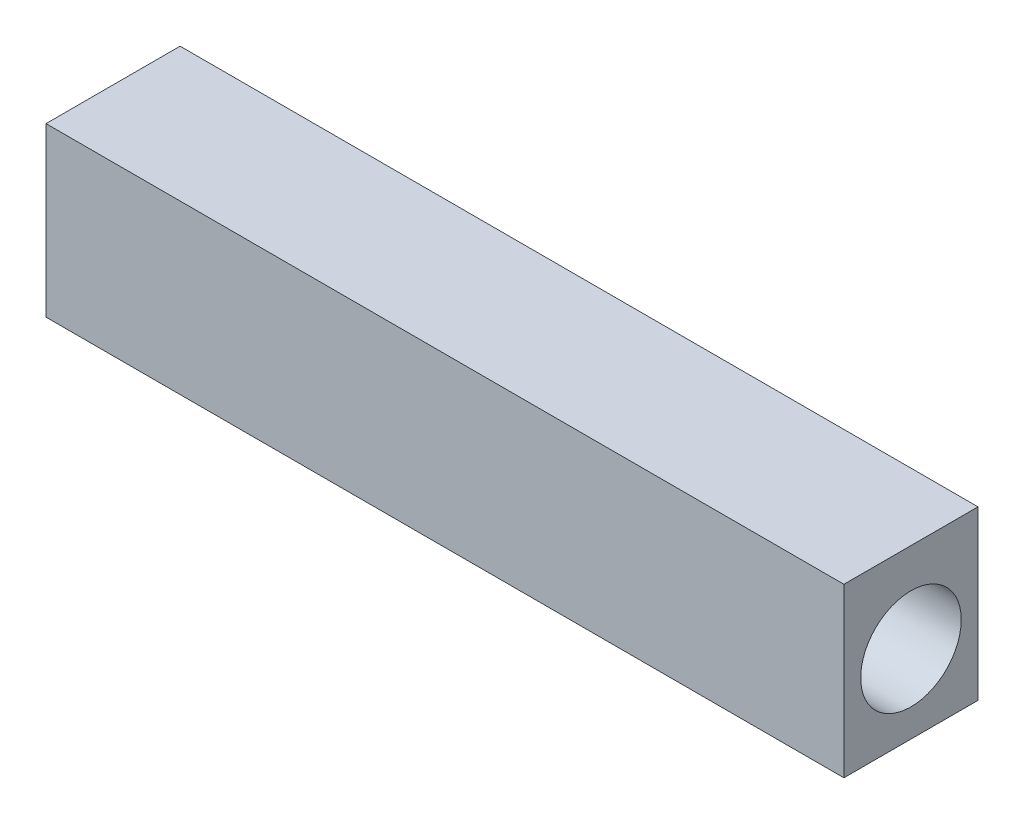
from build123d import *

# Parameters (mm, degrees)
SKETCH_1_W          = 32.4
SKETCH_1_H          = 12
EXTRUDE_1_DEPTH     = 10
SKETCH_4_R          = 4
CUT_EXTRUDE_2_DEPTH = 8.5
SKETCH_7_R          = 3.4
CUT_EXTRUDE_3_DEPTH = 7.9
SKETCH_8_R          = 4.5
CUT_EXTRUDE_4_DEPTH = 16
SKETCH_9_W          = 32.4
SKETCH_9_H          = 2.645898034
EXTRUDE_2_DEPTH     = 5
EXTRUDE_3_DEPTH     = 5
EXTRUDE_4_DEPTH     = 5
SKETCH_12_W         = 12
SKETCH_12_H         = 5
EXTRUDE_5_DEPTH     = 32.4
SKETCH_13_R         = 4
CUT_EXTRUDE_5_DEPTH = 8.5
SKETCH_14_R         = 3.4
CUT_EXTRUDE_6_DEPTH = 7.9
SKETCH_15_R         = 4.5
CUT_EXTRUDE_8_DEPTH = 16
SKETCH_16_W         = 12
SKETCH_16_H         = 15
EXTRUDE_8_DEPTH     = 39
SKETCH_17_R         = 4.5
CUT_EXTRUDE_9_DEPTH = 39


with BuildPart() as part:
    # 草圖1 → 填料-伸長1 (new body)
    with BuildSketch(Plane(origin=(0, 0, 0), x_dir=(1, 0, 0), z_dir=(0, 1, 0))):
        Rectangle(SKETCH_1_W, SKETCH_1_H)
    extrude(amount=EXTRUDE_1_DEPTH)

    # 草圖4 → 除料-伸長2 (cut)
    with BuildSketch(Plane.ZY.offset(16.2)):
        with Locations((0, 7)):
            Circle(SKETCH_4_R)
    extrude(amount=-CUT_EXTRUDE_2_DEPTH, mode=Mode.SUBTRACT)

    # 草圖7 → 除料-伸長3 (cut)
    with BuildSketch(Plane.ZY.offset(7.7)):
        with Locations((0, 7)):
            Circle(SKETCH_7_R)
    extrude(amount=-CUT_EXTRUDE_3_DEPTH, mode=Mode.SUBTRACT)

    # 草圖8 → 除料-伸長4 (cut)
    with BuildSketch(Plane(origin=(16.2, 0, 0), x_dir=(0, 0, -1), z_dir=(1, 0, 0))):
        with Locations((0, 7)):
            Circle(SKETCH_8_R)
    extrude(amount=-CUT_EXTRUDE_4_DEPTH, mode=Mode.SUBTRACT)

    # 草圖9 → 填料-伸長2 (add)
    with BuildSketch(Plane(origin=(0, 10, 0), x_dir=(1, 0, 0), z_dir=(0, 1, 0))):
        with Locations((0, 4.677050983)):
            Rectangle(SKETCH_9_W, SKETCH_9_H)
    extrude(amount=EXTRUDE_2_DEPTH)

    # 草圖10 → 填料-伸長3 (add)
    with BuildSketch(Plane(origin=(0, 10, 0), x_dir=(1, 0, 0), z_dir=(0, 1, 0))):
        Polygon((-16.2, 3.372532617), (-16.2, 2.685476071), (-7.7, 2.645751311), (-7.7, 1.6), (0.2, 1.6), (0.2, 3.354101966), align=None)
    extrude(amount=EXTRUDE_3_DEPTH)

    # 草圖11 → 填料-伸長4 (add)
    with BuildSketch(Plane(origin=(0, 10, 0), x_dir=(1, 0, 0), z_dir=(0, 1, 0))):
        Polygon((-16.2, -2.660675208), (-16.2, -6), (16.2, -6), (16.2, -3.354101966), (0.2, -3.354101966), (0.2, -1.6), (-7.7, -1.6), (-7.7, -2.645751311), align=None)
    extrude(amount=EXTRUDE_4_DEPTH)

    # 草圖12 → 填料-伸長5 (add, through all)
    with BuildSketch(Plane.ZY.offset(16.2)):
        with Locations((0, 12.5)):
            Rectangle(SKETCH_12_W, SKETCH_12_H)
    extrude(amount=-EXTRUDE_5_DEPTH)

    # 草圖13 → 除料-伸長5 (cut)
    with BuildSketch(Plane.ZY.offset(16.2)):
        with Locations((0, 7)):
            Circle(SKETCH_13_R)
    extrude(amount=-CUT_EXTRUDE_5_DEPTH, mode=Mode.SUBTRACT)

    # 草圖14 → 除料-伸長6 (cut)
    with BuildSketch(Plane.ZY.offset(7.7)):
        with Locations((0, 7)):
            Circle(SKETCH_14_R)
    extrude(amount=-CUT_EXTRUDE_6_DEPTH, mode=Mode.SUBTRACT)

    # 草圖15 → 除料-伸長8 (cut)
    with BuildSketch(Plane(origin=(16.2, 0, 0), x_dir=(0, 0, -1), z_dir=(1, 0, 0))):
        with Locations((0, 7)):
            Circle(SKETCH_15_R)
    extrude(amount=-CUT_EXTRUDE_8_DEPTH, mode=Mode.SUBTRACT)

    # 草圖16 → 填料-伸長8 (add)
    with BuildSketch(Plane(origin=(16.2, 0, 0), x_dir=(0, 0, -1), z_dir=(1, 0, 0))):
        with Locations((0, 7.5)):
            Rectangle(SKETCH_16_W, SKETCH_16_H)
    extrude(amount=EXTRUDE_8_DEPTH)

    # 草圖17 → 除料-伸長9 (cut)
    with BuildSketch(Plane(origin=(55.2, 0, 0), x_dir=(0, 0, -1), z_dir=(1, 0, 0))):
        with Locations((0, 7)):
            Circle(SKETCH_17_R)
    extrude(amount=-CUT_EXTRUDE_9_DEPTH, mode=Mode.SUBTRACT)


solid = part.part
